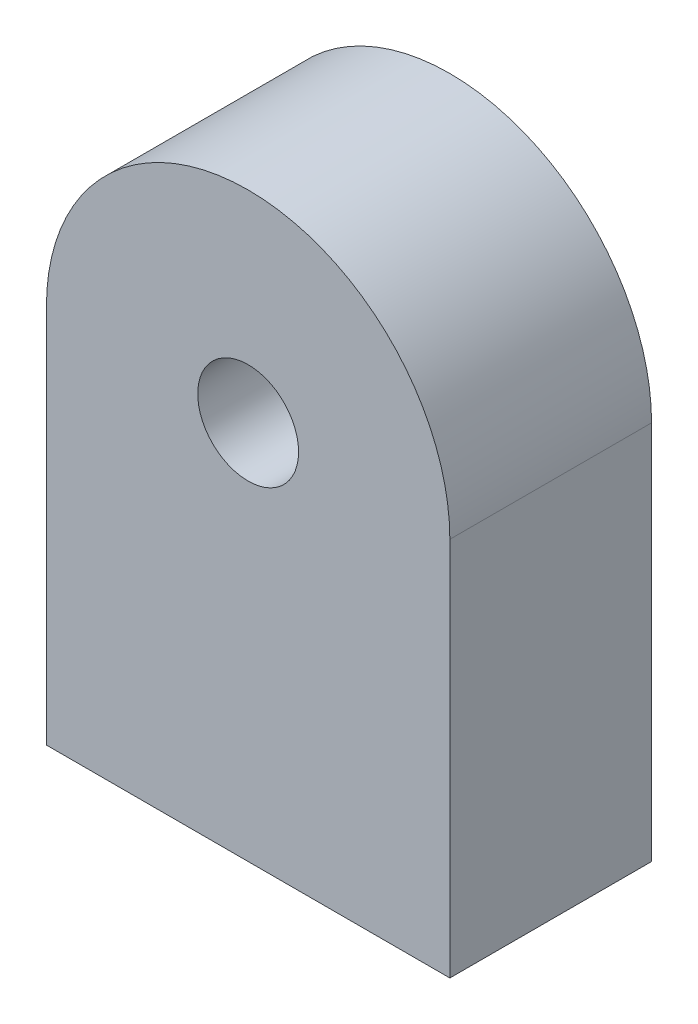
from build123d import *

# Parameters (mm, degrees)
SKETCH1_R           = 6.35
BOSS_EXTRUDE1_DEPTH = 25.4


with BuildPart() as part:
    # Sketch1 → Boss-Extrude1 (new body)
    with BuildSketch(Plane.XY):
        with BuildLine():
            Line((-25.4, 0), (-25.4, -47.842310203))
            Line((-25.4, -47.842310203), (25.4, -47.842310203))
            Line((25.4, -47.842310203), (25.4, 0))
            ThreePointArc((25.4, 0), (0, 25.4), (-25.4, 0))
        make_face()
        Circle(SKETCH1_R, mode=Mode.SUBTRACT)
    extrude(amount=BOSS_EXTRUDE1_DEPTH)


solid = part.part
